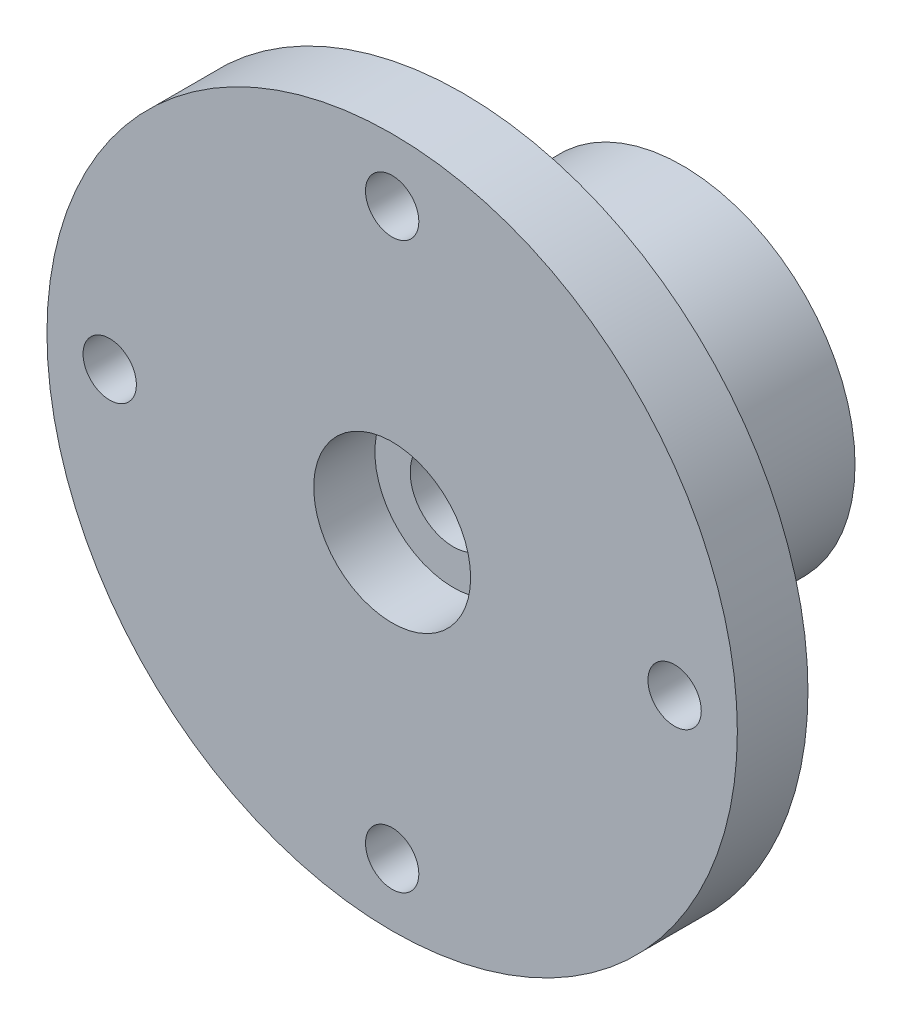
from build123d import *

# Parameters (mm, degrees)
SKETCH1_R                                            = 11
BOSS_EXTRUDE1_DEPTH                                  = 14
SKETCH2_R                                            = 22
BOSS_EXTRUDE2_DEPTH                                  = 4.5
M3_CLEARANCE_HOLE1_D                                 = 3.4
CBORE_FOR_M5_HEX_SOCKET_THIN_HEAD_CAP_SC_D           = 5.5
CBORE_FOR_M5_HEX_SOCKET_THIN_HEAD_CAP_SC_CBORE_D     = 10
CBORE_FOR_M5_HEX_SOCKET_THIN_HEAD_CAP_SC_CBORE_DEPTH = 3.9
FILLET1_R                                            = 0.5


with BuildPart() as part:
    # Sketch1 → Boss-Extrude1 (new body)
    with BuildSketch(Plane.XY):
        Circle(SKETCH1_R)
    extrude(amount=BOSS_EXTRUDE1_DEPTH)

    # Sketch2 → Boss-Extrude2 (add)
    with BuildSketch(Plane.XY.offset(14)):
        Circle(SKETCH2_R)
    extrude(amount=BOSS_EXTRUDE2_DEPTH)

    # M3 Clearance Hole1 (through all)
    with Locations(Plane.XY.offset(18.5)):
        with Locations((-18, 0), (0, 18), (18, 0), (0, -18)):
            Hole(M3_CLEARANCE_HOLE1_D / 2)

    # CBORE for M5 Hex Socket Thin Head Cap Screw1 (through all)
    with Locations(Plane.XY.offset(18.5)):
        with Locations((0, 0)):
            CounterBoreHole(CBORE_FOR_M5_HEX_SOCKET_THIN_HEAD_CAP_SC_D / 2, CBORE_FOR_M5_HEX_SOCKET_THIN_HEAD_CAP_SC_CBORE_D / 2, CBORE_FOR_M5_HEX_SOCKET_THIN_HEAD_CAP_SC_CBORE_DEPTH)

    # Fillet1
    fillet1_edges = [part.edges().sort_by_distance(p)[0] for p in [
        (-11, 0, 14),
    ]]
    fillet(fillet1_edges, radius=FILLET1_R)


solid = part.part
